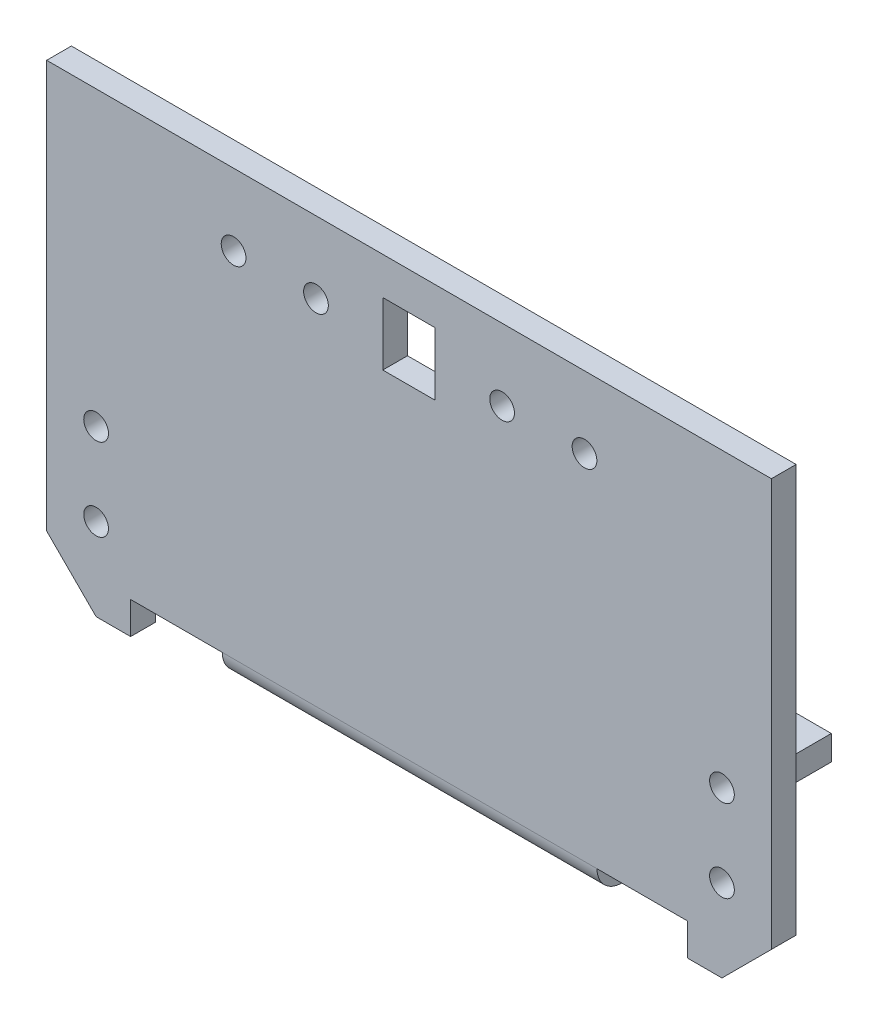
from build123d import *

# Parameters (mm, degrees)
BOSS_EXTRUDE1_DEPTH = 3
SKETCH2_R           = 1.5
CUT_EXTRUDE1_DEPTH  = 3
SKETCH3_W           = 6.35
SKETCH3_H           = 7.620000001
CUT_EXTRUDE2_DEPTH  = 3
BOSS_EXTRUDE2_DEPTH = 3
FILLET2_R           = 3


with BuildPart() as part:
    # Sketch1 → Boss-Extrude1 (new body)
    with BuildSketch(Plane.XY):
        Polygon((-33.787864348, 18.602457347), (-33.787864348, 14.699262249), (-37.97594504, 14.699262249), (-43.97594504, 20.699262249), (-43.97594504, 28.455124303), (-43.97594504, 70.175124303), (43.97594504, 70.175124303), (43.97594504, 28.455124303), (43.97594504, 20.699262249), (37.97594504, 14.699262249), (33.787864348, 14.699262249), (33.787864348, 18.602457347), align=None)
    extrude(amount=BOSS_EXTRUDE1_DEPTH)

    # Sketch2 → Cut-Extrude1 (cut)
    with BuildSketch(Plane.XY.offset(3)):
        with Locations((37.97594504, 24.699262249)):
            Circle(SKETCH2_R)
        with Locations((37.97594504, 34.699262249)):
            Circle(SKETCH2_R)
        with Locations(Location((-37.97594504, 24.699262249, 0), (0, 0, 180))):
            Circle(SKETCH2_R)
        with Locations(Location((-37.97594504, 34.699262249, 0), (0, 0, 180))):
            Circle(SKETCH2_R)
        with Locations((21.293781262, 61.478152505)):
            Circle(SKETCH2_R)
        with Locations((11.293781262, 61.478152505)):
            Circle(SKETCH2_R)
        with Locations(Location((-11.293781262, 61.478152505, 0), (0, 0, 180))):
            Circle(SKETCH2_R)
        with Locations(Location((-21.293781262, 61.478152505, 0), (0, 0, 180))):
            Circle(SKETCH2_R)
    extrude(amount=-CUT_EXTRUDE1_DEPTH, mode=Mode.SUBTRACT)

    # Sketch3 → Cut-Extrude2 (cut)
    with BuildSketch(Plane(origin=(0, 0, 0), x_dir=(-1, 0, 0), z_dir=(0, 0, -1))):
        with Locations((0.00872995, 61.826506665)):
            Rectangle(SKETCH3_W, SKETCH3_H)
    extrude(amount=-CUT_EXTRUDE2_DEPTH, mode=Mode.SUBTRACT)

    # Sketch4 → Boss-Extrude2 (add)
    with BuildSketch(Plane.XZ.offset(-18.602457347)):
        Polygon((-12.685088164, -20.434120829), (14.947571964, -20.434120829), (14.947571964, -25.434120829), (22.815283287, -25.434120829), (22.815283287, 3), (-22.664716713, 3), (-22.664716713, -25.434120829), (-12.685088164, -25.434120829), align=None)
    extrude(amount=BOSS_EXTRUDE2_DEPTH)

    # Fillet2
    fillet2_edges = [part.edges().sort_by_distance(p)[0] for p in [
        (0.075283287, 15.602457347, 3),
    ]]
    fillet(fillet2_edges, radius=FILLET2_R)


solid = part.part
